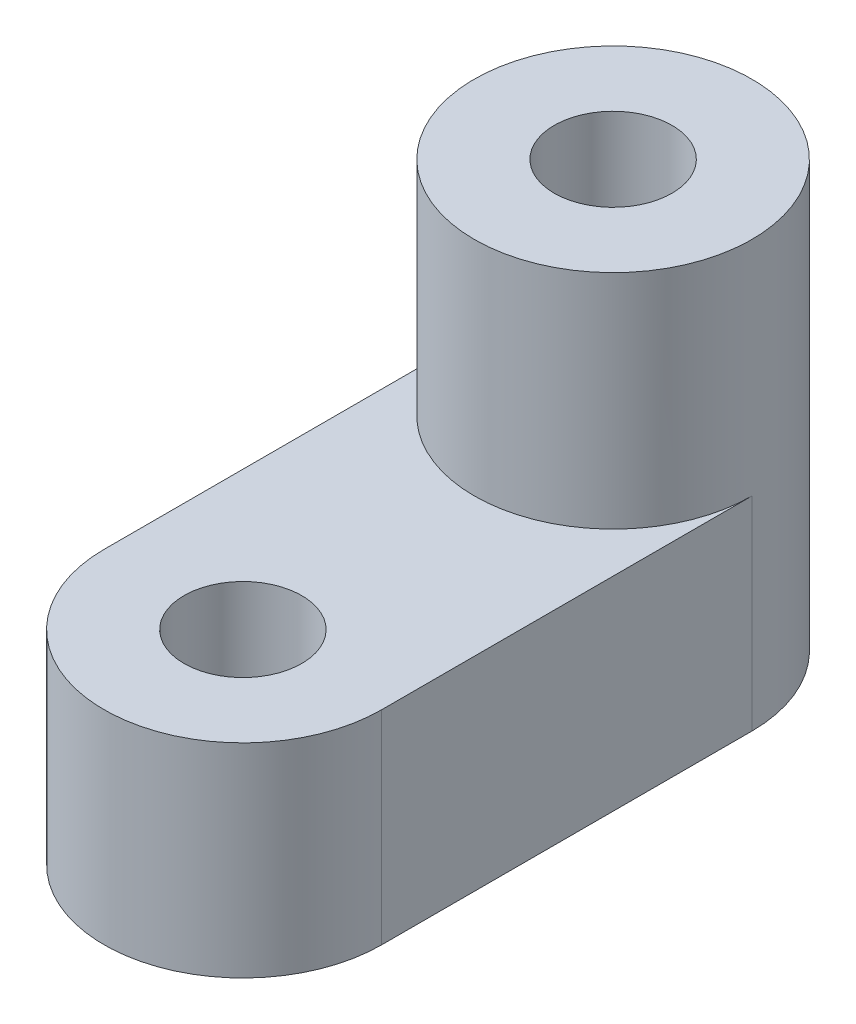
from build123d import *

# Parameters (mm, degrees)
BOSS_EXTRUDE1_DEPTH             = 5.5
SKETCH2_R                       = 1.59
CUT_EXTRUDE1_DEPTH              = 13.013013777
SKETCH3_R                       = 3.75
BOSS_EXTRUDE2_DEPTH             = 6
BOSS_EXTRUDE2_DIRECTION_2_REACH = 14.013
SKETCH4_R                       = 1.59
CUT_EXTRUDE2_DEPTH              = 10


with BuildPart() as part:
    # Sketch1 → Boss-Extrude1 (new body)
    with BuildSketch(Plane(origin=(0, 0, 0), x_dir=(1, 0, 0), z_dir=(0, 1, 0))):
        with BuildLine():
            Line((-3.75, 10), (-3.75, 0))
            ThreePointArc((-3.75, 0), (0, -3.75), (3.75, 0))
            Line((3.75, 0), (3.75, 10))
            Line((3.75, 10), (-3.75, 10))
        make_face()
    extrude(amount=BOSS_EXTRUDE1_DEPTH)

    # Sketch2 → Cut-Extrude1 (cut, through all)
    with BuildSketch(Plane(origin=(0, 5.5, 0), x_dir=(1, 0, 0), z_dir=(0, 1, 0))):
        with Locations(Location((0, 0, 0), (0, 0, 270))):
            Circle(SKETCH2_R)
    extrude(amount=-CUT_EXTRUDE1_DEPTH, mode=Mode.SUBTRACT)

    # Sketch3 → Boss-Extrude2 (add)
    with BuildSketch(Plane(origin=(0, 5.5, 0), x_dir=(1, 0, 0), z_dir=(0, 1, 0))):
        with Locations(Location((0, 10, 0), (0, 0, 270))):
            Circle(SKETCH3_R)
    extrude(amount=BOSS_EXTRUDE2_DEPTH)

    # Boss-Extrude2 direction 2: up to this face of the body (flat: up to its plane)
    boss_extrude2_direction_2_end = Plane(part.part.faces().sort_by_distance((0, 0, -3.812169899))[0])
    # Sketch3 → Boss-Extrude2 direction 2 (add, up to the picked face)
    with BuildSketch(Plane(origin=(0, 5.5, 0), x_dir=(1, 0, 0), z_dir=(0, 1, 0)), mode=Mode.PRIVATE) as boss_extrude2_direction_2_sk1:
        with Locations(Location((0, 10, 0), (0, 0, 270))):
            Circle(SKETCH3_R)
    boss_extrude2_direction_2_tool1 = split(extrude(boss_extrude2_direction_2_sk1.sketch, amount=-BOSS_EXTRUDE2_DIRECTION_2_REACH, mode=Mode.PRIVATE), bisect_by=boss_extrude2_direction_2_end, keep=Keep.BOTH, mode=Mode.PRIVATE)
    add(boss_extrude2_direction_2_tool1.solids().sort_by(Axis((0, 5.5, -10), (0, -1, 0)))[0])

    # Sketch4 → Cut-Extrude2 (cut)
    with BuildSketch(Plane(origin=(0, 11.5, 0), x_dir=(1, 0, 0), z_dir=(0, 1, 0))):
        with Locations(Location((0, 10, 0), (0, 0, 270))):
            Circle(SKETCH4_R)
    extrude(amount=-CUT_EXTRUDE2_DEPTH, mode=Mode.SUBTRACT)


solid = part.part
